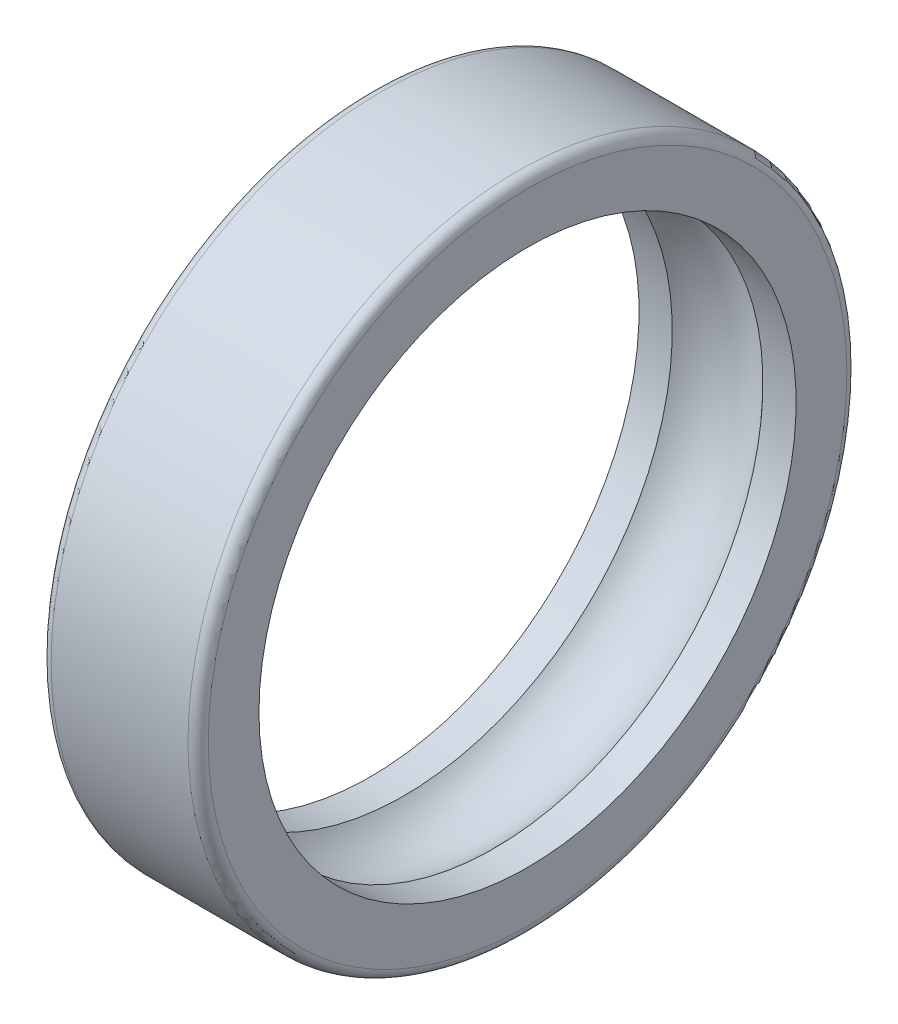
from build123d import *

# Parameters (mm, degrees)
FILLET_1_R = 2


with BuildPart() as part:
    # 草圖1 → 旋轉1 (revolve)
    with BuildSketch(Plane.XY, mode=Mode.PRIVATE) as revolve_1_sk:
        with BuildLine():
            Line((-11.110961599, 65), (19.889038401, 65))
            Line((19.889038401, 65), (19.889038401, 53))
            Line((19.889038401, 53), (13.333310311, 53))
            ThreePointArc((13.333310311, 53), (4.389038401, 57), (-4.555233509, 53))
            Line((-4.555233509, 53), (-11.110961599, 53))
            Line((-11.110961599, 53), (-11.110961599, 65))
        make_face()
    revolve(revolve_1_sk.sketch.rotate(Axis((0, 0, 0), (1, 0, 0)), 90), axis=Axis((0, 0, 0), (1, 0, 0)))

    # 圓角1
    fillet_1_edges = [part.edges().sort_by_distance(p)[0] for p in [
        (-11.110961599, 0, -65),
        (19.889038401, 0, -65),
    ]]
    fillet(fillet_1_edges, radius=FILLET_1_R)


solid = part.part
